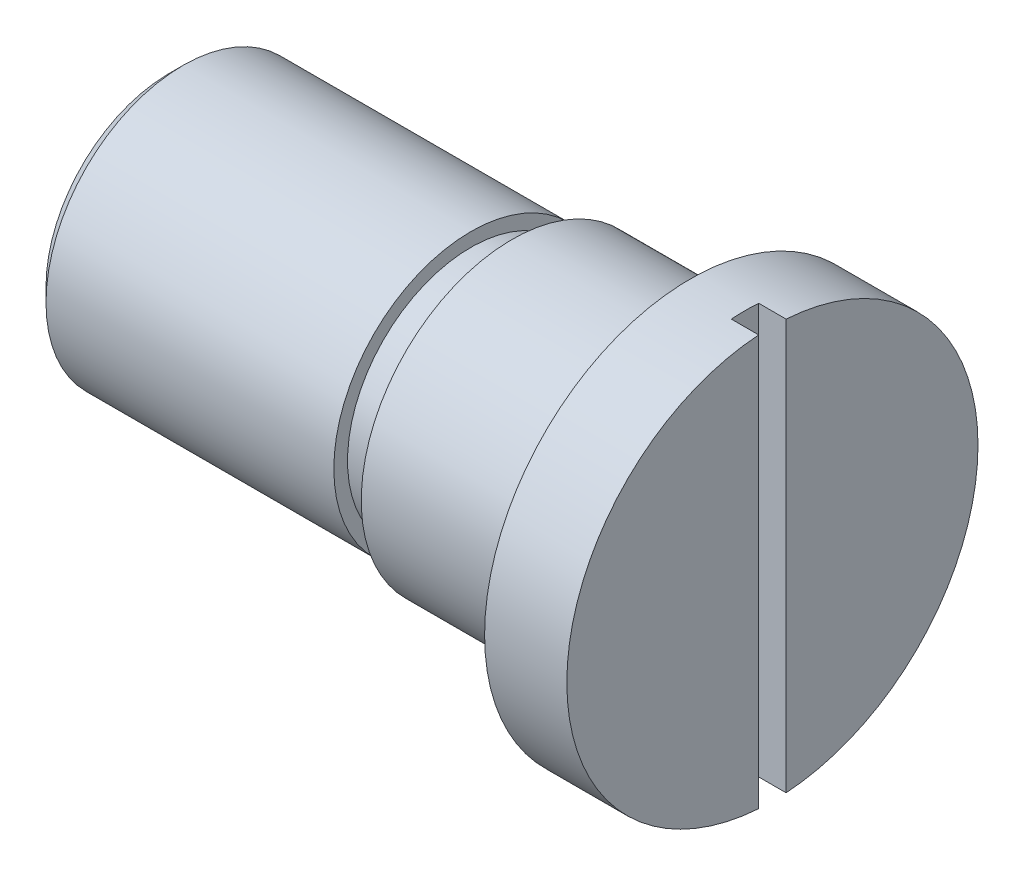
from build123d import *

# Parameters (mm, degrees)
KES_EKSTR_ZYON1_DEPTH      = 49.846698967
KES_EKSTR_ZYON1_DEPTH_BACK = 49.846698967
PAH1_SIZE                  = 1


with BuildPart() as part:
    # Çizim1 → Döndür1 (revolve)
    with BuildSketch(Plane.XY, mode=Mode.PRIVATE) as d_nd_r1_sk:
        Polygon((0, 0), (0, 15), (-6, 15), (-6, 11), (-19, 11), (-19, 9), (-22, 9), (-22, 10), (-44, 10), (-44, 0), align=None)
    revolve(d_nd_r1_sk.sketch.rotate(Axis((0, 0, 0), (-1, 0, 0)), 90), axis=Axis((0, 0, 0), (-1, 0, 0)))

    # Çizim2 → Kes-Ekstrüzyon1 (cut, two sides: drawn at the far end of the back side and taken through both)
    with BuildSketch(Plane(origin=(0, 0, 0), x_dir=(1, 0, 0), z_dir=(0, 1, 0)).offset(-KES_EKSTR_ZYON1_DEPTH_BACK)):
        Polygon((0, 0), (0, 1), (-2, 1), (-2, -1), (0, -1), align=None)
    extrude(amount=KES_EKSTR_ZYON1_DEPTH + KES_EKSTR_ZYON1_DEPTH_BACK, mode=Mode.SUBTRACT)

    # Pah1
    pah1_edges = [part.edges().sort_by_distance(p)[0] for p in [
        (-44, 0, 10),
    ]]
    chamfer(pah1_edges, length=PAH1_SIZE)


solid = part.part
